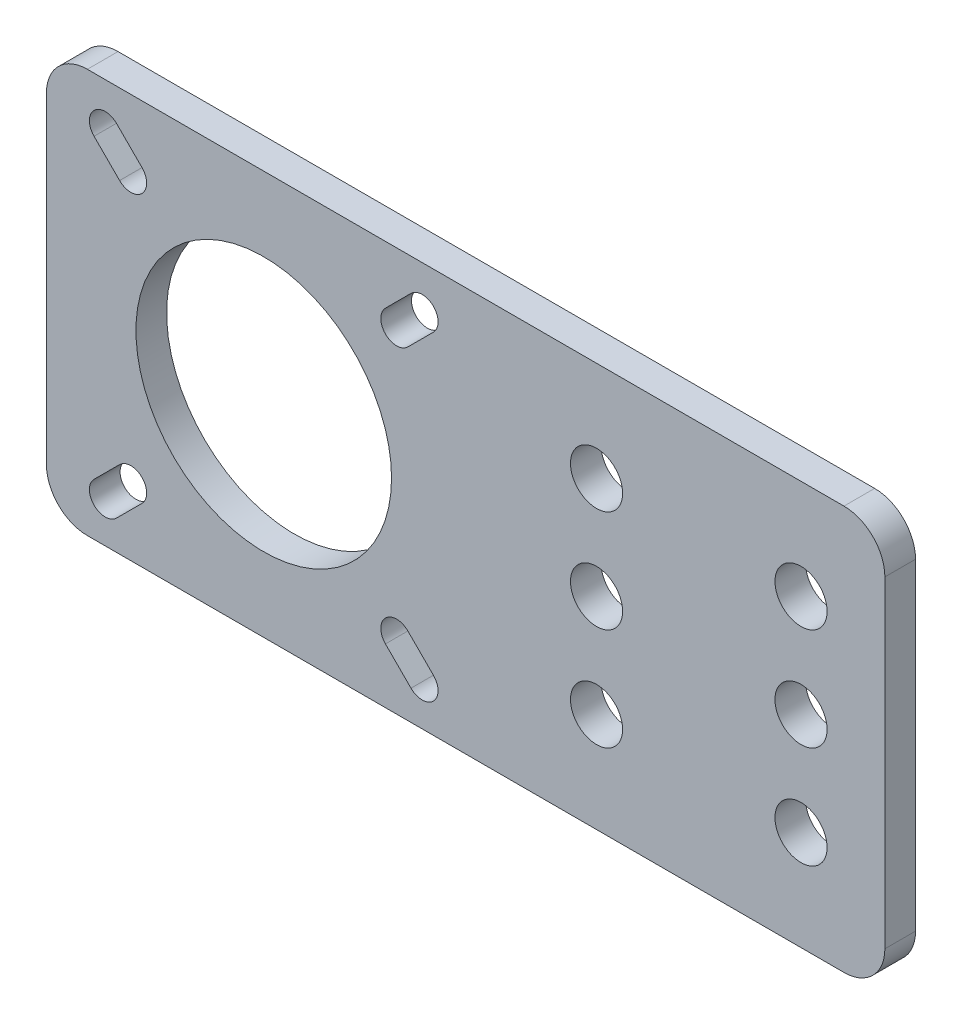
from build123d import *

# Parameters (mm, degrees)
CROQUIS1_R              = 12.5
CROQUIS1_R_2            = 2.55
SALIENTE_EXTRUIR1_DEPTH = 3


with BuildPart() as part:
    # Croquis1 → Saliente-Extruir1 (new body)
    with BuildSketch(Plane.XY):
        with BuildLine():
            Line((-36.073713386, 51.832792666), (37.926286614, 51.832792666))
            ThreePointArc((37.926286614, 51.832792666), (40.754713739, 50.66121979), (41.926286614, 47.832792666))
            Line((41.926286614, 47.832792666), (41.926286614, 16.332792666))
            ThreePointArc((41.926286614, 16.332792666), (40.754713739, 13.504365541), (37.926286614, 12.332792666))
            Line((37.926286614, 12.332792666), (-36.073713386, 12.332792666))
            ThreePointArc((-36.073713386, 12.332792666), (-38.902140511, 13.504365541), (-40.073713386, 16.332792666))
            Line((-40.073713386, 16.332792666), (-40.073713386, 47.832792666))
            ThreePointArc((-40.073713386, 47.832792666), (-38.902140511, 50.66121979), (-36.073713386, 51.832792666))
        make_face()
        with Locations((-18.823713386, 32.082792666)):
            Circle(CROQUIS1_R, mode=Mode.SUBTRACT)
        with Locations((33.726286614, 22.082792666)):
            Circle(CROQUIS1_R_2, mode=Mode.SUBTRACT)
        with Locations((33.726286614, 32.082792666)):
            Circle(CROQUIS1_R_2, mode=Mode.SUBTRACT)
        with Locations((33.726286614, 42.082792666)):
            Circle(CROQUIS1_R_2, mode=Mode.SUBTRACT)
        with Locations((13.726286614, 22.082792666)):
            Circle(CROQUIS1_R_2, mode=Mode.SUBTRACT)
        with Locations((13.726286614, 32.082792666)):
            Circle(CROQUIS1_R_2, mode=Mode.SUBTRACT)
        with Locations((13.726286614, 42.082792666)):
            Circle(CROQUIS1_R_2, mode=Mode.SUBTRACT)
        with BuildLine():
            Line((-4.419728897, 15.236777155), (-6.919728897, 17.736777155))
            ThreePointArc((-6.919728897, 17.736777155), (-6.919728897, 19.928808177), (-4.727697875, 19.928808177))
            Line((-4.727697875, 19.928808177), (-2.227697875, 17.428808177))
            ThreePointArc((-2.227697875, 17.428808177), (-2.227697875, 15.236777155), (-4.419728897, 15.236777155))
        make_face(mode=Mode.SUBTRACT)
        with BuildLine():
            Line((-35.419728897, 17.428808177), (-32.919728897, 19.928808177))
            ThreePointArc((-32.919728897, 19.928808177), (-30.727697875, 19.928808177), (-30.727697875, 17.736777155))
            Line((-30.727697875, 17.736777155), (-33.227697875, 15.236777155))
            ThreePointArc((-33.227697875, 15.236777155), (-35.419728897, 15.236777155), (-35.419728897, 17.428808177))
        make_face(mode=Mode.SUBTRACT)
        with BuildLine():
            Line((-2.227697875, 46.486777155), (-4.727697875, 43.986777155))
            ThreePointArc((-4.727697875, 43.986777155), (-6.919728897, 43.986777155), (-6.919728897, 46.178808177))
            Line((-6.919728897, 46.178808177), (-4.419728897, 48.678808177))
            ThreePointArc((-4.419728897, 48.678808177), (-2.227697875, 48.678808177), (-2.227697875, 46.486777155))
        make_face(mode=Mode.SUBTRACT)
        with BuildLine():
            Line((-33.227697875, 48.678808177), (-30.727697875, 46.178808177))
            ThreePointArc((-30.727697875, 46.178808177), (-30.727697875, 43.986777155), (-32.919728897, 43.986777155))
            Line((-32.919728897, 43.986777155), (-35.419728897, 46.486777155))
            ThreePointArc((-35.419728897, 46.486777155), (-35.419728897, 48.678808177), (-33.227697875, 48.678808177))
        make_face(mode=Mode.SUBTRACT)
    extrude(amount=SALIENTE_EXTRUIR1_DEPTH)


solid = part.part
